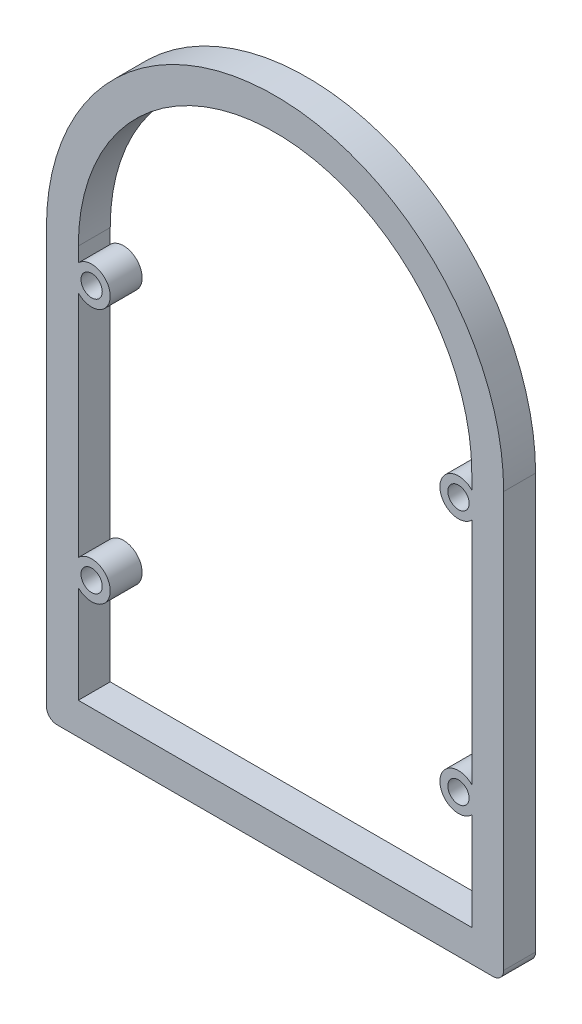
from build123d import *

# Parameters (mm, degrees)
SKETCH1_R           = 1
BOSS_EXTRUDE1_DEPTH = 3


with BuildPart() as part:
    # Sketch1 → Boss-Extrude1 (new body)
    with BuildSketch(Plane.XY):
        with BuildLine():
            ThreePointArc((21.5, 20.5), (0, 42), (-21.5, 20.5))
            Line((-21.5, 20.5), (-21.5, -18.5))
            ThreePointArc((-21.5, -18.5), (-21.207106781, -19.207106781), (-20.5, -19.5))
            Line((-20.5, -19.5), (20.5, -19.5))
            ThreePointArc((20.5, -19.5), (21.207106781, -19.207106781), (21.5, -18.5))
            Line((21.5, -18.5), (21.5, 20.5))
        make_face()
        with Locations((-17.25, -6.1)):
            Circle(SKETCH1_R, mode=Mode.SUBTRACT)
        with Locations((-17.25, 17.9)):
            Circle(SKETCH1_R, mode=Mode.SUBTRACT)
        with BuildLine():
            ThreePointArc((-18.5, -7.324744871), (-15.636648903, -6.77793675), (-17.25, -4.35))
            ThreePointArc((-17.25, -4.35), (-17.92793675, -4.486648903), (-18.5, -4.875255129))
            Line((-18.5, -4.875255129), (-18.5, 16.675255129))
            ThreePointArc((-18.5, 16.675255129), (-17.92793675, 16.286648903), (-17.25, 16.15))
            ThreePointArc((-17.25, 16.15), (-15.636648903, 18.57793675), (-18.5, 19.124744871))
            Line((-18.5, 19.124744871), (-18.5, 20.5))
            ThreePointArc((-18.5, 20.5), (0, 39), (18.5, 20.5))
            Line((18.5, 20.5), (18.5, 19.124744871))
            ThreePointArc((18.5, 19.124744871), (15.636648903, 18.57793675), (17.25, 16.15))
            ThreePointArc((17.25, 16.15), (17.92793675, 16.286648903), (18.5, 16.675255129))
            Line((18.5, 16.675255129), (18.5, -4.875255129))
            ThreePointArc((18.5, -4.875255129), (17.92793675, -4.486648903), (17.25, -4.35))
            ThreePointArc((17.25, -4.35), (15.636648903, -6.77793675), (18.5, -7.324744871))
            Line((18.5, -7.324744871), (18.5, -16.5))
            Line((18.5, -16.5), (-18.5, -16.5))
            Line((-18.5, -16.5), (-18.5, -7.324744871))
        make_face(mode=Mode.SUBTRACT)
        with Locations((17.25, 17.9)):
            Circle(SKETCH1_R, mode=Mode.SUBTRACT)
        with Locations((17.25, -6.1)):
            Circle(SKETCH1_R, mode=Mode.SUBTRACT)
    extrude(amount=BOSS_EXTRUDE1_DEPTH)


solid = part.part
